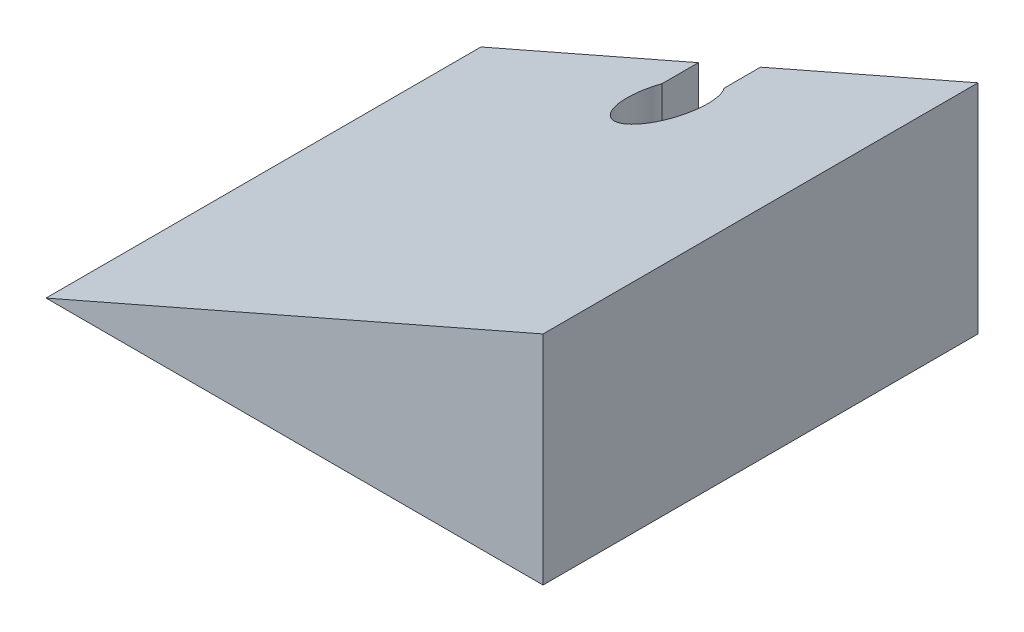
from build123d import *

# Parameters (mm, degrees)
RESSALTO_EXTRUS_O1_DEPTH = 70
CORTE_EXTRUS_O1_DEPTH    = 70


with BuildPart() as part:
    # Esboço1 → Ressalto-extrusão1 (new body)
    with BuildSketch(Plane.XY):
        Polygon((-46.166666667, -15.652777778), (33.833333333, 19.347222222), (33.833333333, -15.652777778), align=None)
    extrude(amount=RESSALTO_EXTRUS_O1_DEPTH)

    # Esboço2 → Corte-extrusão1 (cut)
    with BuildSketch(Plane.XZ.offset(15.652777778)):
        with BuildLine():
            Line((-11.166666667, 0), (-1.166666667, 0))
            Line((-1.166666667, 0), (-1.166666667, 5.846688069))
            ThreePointArc((-1.166666667, 5.846688069), (-6.166666667, 16.5), (-11.166666667, 5.846688069))
            Line((-11.166666667, 5.846688069), (-11.166666667, 0))
        make_face()
    extrude(amount=-CORTE_EXTRUS_O1_DEPTH, mode=Mode.SUBTRACT)


solid = part.part
